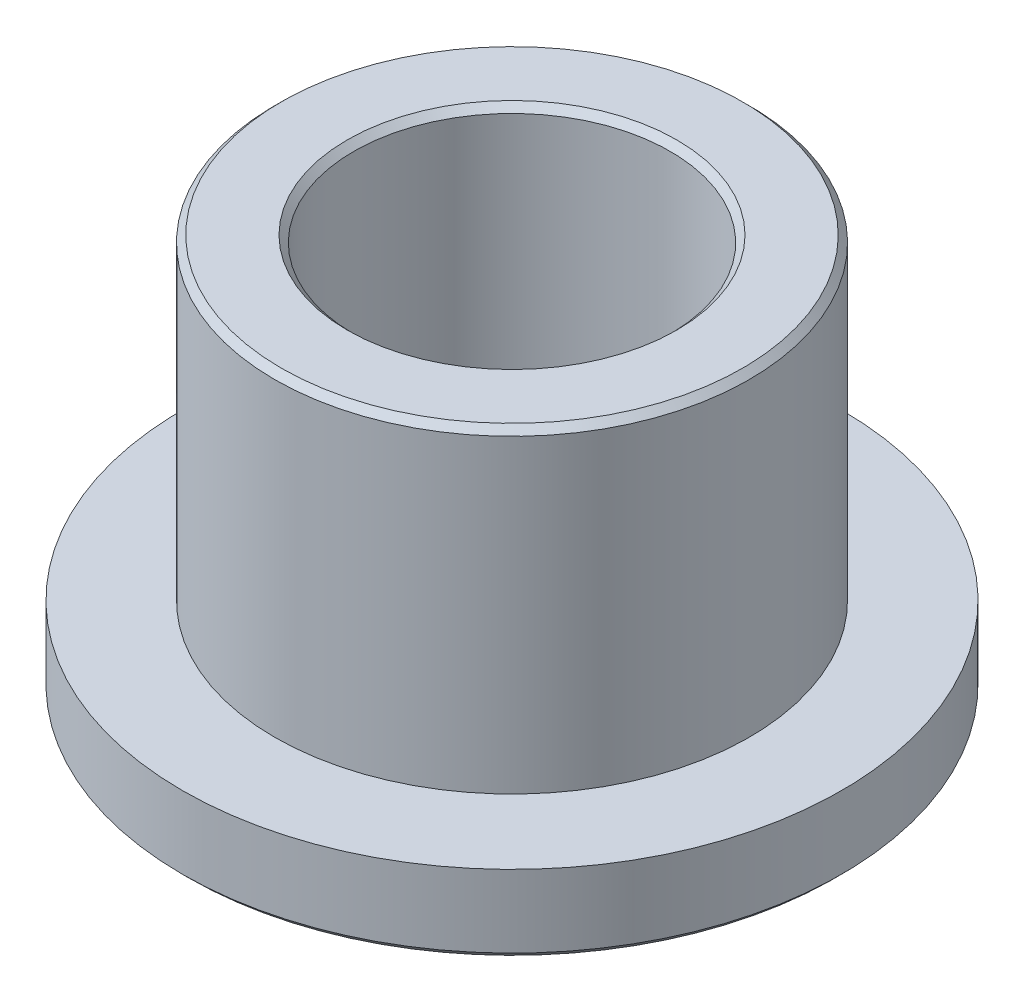
from build123d import *

# Parameters (mm, degrees)
SKETCH_1_R      = 12.5
SKETCH_1_R_2    = 6
EXTRUDE_1_DEPTH = 3
SKETCH_2_R      = 9
SKETCH_2_R_2    = 6
EXTRUDE_2_DEPTH = 12
CHAMFER_1_SIZE  = 0.25


with BuildPart() as part:
    # 草图1 → 凸台-拉伸1 (new body)
    with BuildSketch(Plane(origin=(0, 0, 0), x_dir=(1, 0, 0), z_dir=(0, 1, 0))):
        with Locations(Location((0, 0, 0), (0, 0, 270))):
            Circle(SKETCH_1_R)
        with Locations(Location((0, 0, 0), (0, 0, 270))):
            Circle(SKETCH_1_R_2, mode=Mode.SUBTRACT)
    extrude(amount=EXTRUDE_1_DEPTH)

    # 草图2 → 凸台-拉伸2 (add)
    with BuildSketch(Plane(origin=(0, 3, 0), x_dir=(1, 0, 0), z_dir=(0, 1, 0))):
        with Locations(Location((0, 0, 0), (0, 0, 270))):
            Circle(SKETCH_2_R)
        with Locations(Location((0, 0, 0), (0, 0, 270))):
            Circle(SKETCH_2_R_2, mode=Mode.SUBTRACT)
    extrude(amount=EXTRUDE_2_DEPTH)

    # 倒角1
    chamfer_1_edges = [part.edges().sort_by_distance(p)[0] for p in [
        (0, 15, -9),
        (0, 15, -6),
        (0, 0, -12.5),
        (0, 0, -6),
    ]]
    chamfer(chamfer_1_edges, length=CHAMFER_1_SIZE)


solid = part.part
